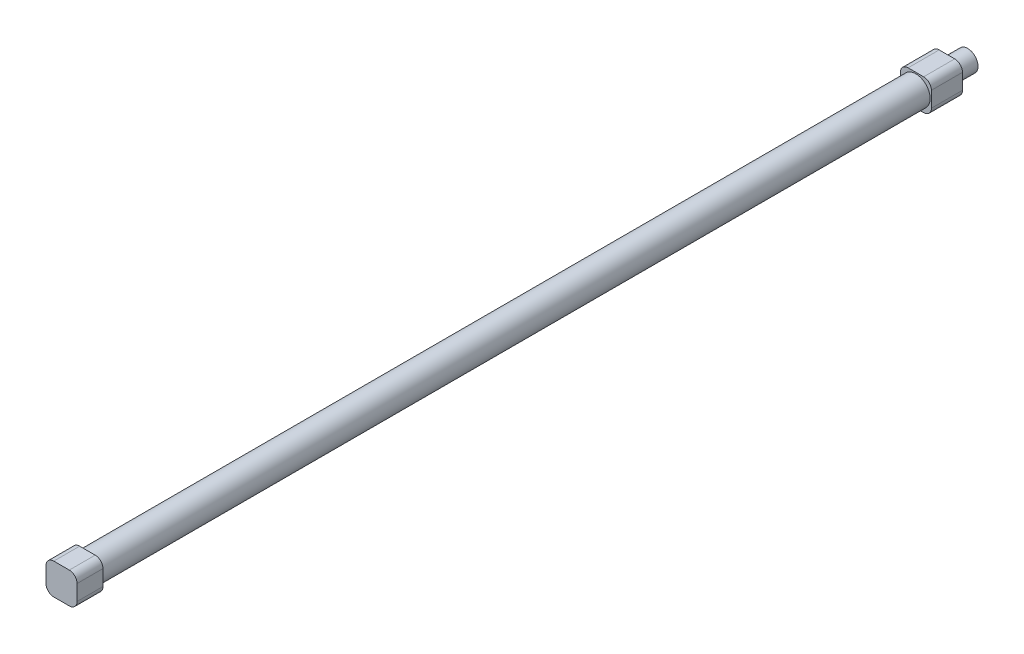
from build123d import *

# Parameters (mm, degrees)
SKETCH_1_R          = 5.5
SKETCH_1_R_2        = 5
EXTRUDE_1_DEPTH     = 320
EXTRUDE_2_DEPTH     = 10
EXTRUDE_START       = 12
EXTRUDE_3_DEPTH     = 12
SKETCH_4_R          = 4
EXTRUDE_4_DEPTH     = 8
SKETCH_5_R          = 2
CUT_EXTRUDE_1_DEPTH = 38
SKETCH_6_R          = 2
CUT_EXTRUDE_3_DEPTH = 3


with BuildPart() as part:
    # 草图1 → 凸台-拉伸1 (new body)
    with BuildSketch(Plane.XY):
        Circle(SKETCH_1_R)
        Circle(SKETCH_1_R_2, mode=Mode.SUBTRACT)
    extrude(amount=EXTRUDE_1_DEPTH)

    # 草图2 → 凸台-拉伸2 (add)
    with BuildSketch(Plane.XY.offset(320)):
        with BuildLine():
            Line((-3, -6), (3, -6))
            ThreePointArc((3, -6), (5.121320344, -5.121320344), (6, -3))
            Line((6, -3), (6, 3))
            ThreePointArc((6, 3), (5.121320344, 5.121320344), (3, 6))
            Line((3, 6), (-3, 6))
            ThreePointArc((-3, 6), (-5.121320344, 5.121320344), (-6, 3))
            Line((-6, 3), (-6, -3))
            ThreePointArc((-6, -3), (-5.121320344, -5.121320344), (-3, -6))
        make_face()
    extrude(amount=EXTRUDE_2_DEPTH)

    # 草图3 → 凸台-拉伸3 (add)
    with BuildSketch(Plane(origin=(0, 0, 0), x_dir=(-1, 0, 0), z_dir=(0, 0, -1)).offset(EXTRUDE_START)):
        with BuildLine():
            Line((-3, -6), (3, -6))
            ThreePointArc((3, -6), (5.121320344, -5.121320344), (6, -3))
            Line((6, -3), (6, 3))
            ThreePointArc((6, 3), (5.121320344, 5.121320344), (3, 6))
            Line((3, 6), (-3, 6))
            ThreePointArc((-3, 6), (-5.121320344, 5.121320344), (-6, 3))
            Line((-6, 3), (-6, -3))
            ThreePointArc((-6, -3), (-5.121320344, -5.121320344), (-3, -6))
        make_face()
    extrude(amount=-EXTRUDE_3_DEPTH)

    # 草图4 → 凸台-拉伸4 (add)
    with BuildSketch(Plane(origin=(0, 0, -12), x_dir=(-1, 0, 0), z_dir=(0, 0, -1))):
        Circle(SKETCH_4_R)
    extrude(amount=EXTRUDE_4_DEPTH)

    # 草图5 → 切除-拉伸1 (cut)
    with BuildSketch(Plane(origin=(0, 0, -20), x_dir=(-1, 0, 0), z_dir=(0, 0, -1))):
        Circle(SKETCH_5_R)
    extrude(amount=-CUT_EXTRUDE_1_DEPTH, mode=Mode.SUBTRACT)

    # 草图6 → 切除-拉伸3 (cut)
    with BuildSketch(Plane.ZY.offset(6)):
        with Locations((-4, 0)):
            Circle(SKETCH_6_R)
        with Locations((324, 0)):
            Circle(SKETCH_6_R)
    extrude(amount=-CUT_EXTRUDE_3_DEPTH, mode=Mode.SUBTRACT)


solid = part.part
